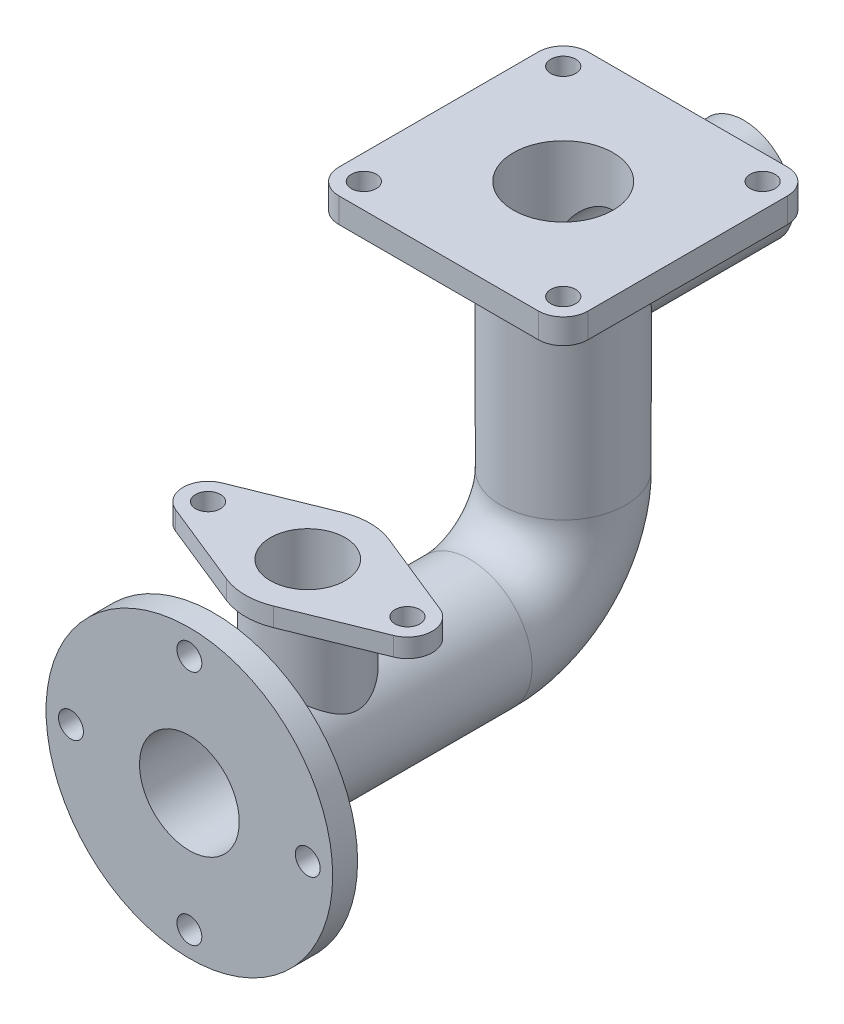
from build123d import *

# Parameters (mm, degrees)
SKETCH2_R                = 12.5
SKETCH2_R_2              = 10
BOSS_EXTRUDE1_START      = -5
SKETCH3_R                = 28.75
SKETCH3_R_2              = 10
BOSS_EXTRUDE1_DEPTH      = 5
HOLE1_D                  = 5
HOLE1_DEPTH              = 5
CIRPATTERN1_COUNT        = 4
SKETCH6_W                = 50
SKETCH6_H                = 50
SKETCH6_R                = 10
BOSS_EXTRUDE2_DEPTH      = 5
FILLET1_R                = 5
HOLE2_D                  = 5
BOSS_EXTRUDE3_REACH      = 120.882
BOSS_EXTRUDE3_END_RADIUS = 12.5
SKETCH9_R                = 10
HOLE3_REACH              = 120.882
HOLE3_BORE_R             = 7.5
SKETCH13_R               = 7.5
SKETCH13_R_2             = 2.5
BOSS_EXTRUDE4_DEPTH      = 3.75
BOSS_EXTRUDE5_REACH      = 135.902
BOSS_EXTRUDE5_END_RADIUS = 12.5
SKETCH14_R               = 10
HOLE4_REACH              = 135.902
HOLE4_BORE_R             = 7.5


with BuildPart() as part:
    # Sweep1: sweep along a path in Sketch1
    with BuildLine(Plane(origin=(0, 0, 0), x_dir=(0, 0, -1), z_dir=(1, 0, 0))) as sweep1_path:
        Line((0, 0), (56.25, 0))
        ThreePointArc((56.25, 0), (69.508252147, 5.491747853), (75, 18.75))
        Line((75, 18.75), (75, 68.75))
    # Sketch2 → Sweep1 (sweep)
    with BuildSketch(Plane.XY):
        Circle(SKETCH2_R)
        Circle(SKETCH2_R_2, mode=Mode.SUBTRACT)
    sweep(path=sweep1_path.line)

    # Sketch3 → Boss-Extrude1 (add)
    with BuildSketch(Plane.XY.offset(BOSS_EXTRUDE1_START)):
        Circle(SKETCH3_R)
        with Locations(Location((0, 0, 0), (0, 0, 270))):
            Circle(SKETCH3_R_2, mode=Mode.SUBTRACT)
    extrude(amount=BOSS_EXTRUDE1_DEPTH)

    # Hole1
    with Locations(Plane.XY):
        with Locations((23.75, 0)):
            hole1 = Hole(HOLE1_D / 2, depth=HOLE1_DEPTH)

    # CirPattern1: Hole1 ×4 about axis
    cirpattern1_axis = Axis((0, 0, 0), (0, 0, 1))
    for i in range(1, CIRPATTERN1_COUNT):
        add(hole1.rotate(cirpattern1_axis, i * 360 / CIRPATTERN1_COUNT), mode=Mode.SUBTRACT)

    # Sketch6 → Boss-Extrude2 (add)
    with BuildSketch(Plane(origin=(0, 68.75, 0), x_dir=(1, 0, 0), z_dir=(0, 1, 0))):
        with Locations((0, 75)):
            Rectangle(SKETCH6_W, SKETCH6_H)
        with Locations((0, 75)):
            Circle(SKETCH6_R, mode=Mode.SUBTRACT)
    extrude(amount=-BOSS_EXTRUDE2_DEPTH)

    # Fillet1
    fillet1_edges = [part.edges().sort_by_distance(p)[0] for p in [
        (25, 66.25, -100),
        (25, 66.25, -50),
        (-25, 66.25, -50),
        (-25, 66.25, -100),
    ]]
    fillet(fillet1_edges, radius=FILLET1_R)

    # Hole2 (through all)
    with Locations(Plane(origin=(0, 68.75, 0), x_dir=(1, 0, 0), z_dir=(0, 1, 0))):
        with Locations((-20, 55), (20, 55), (20, 95), (-20, 95)):
            Hole(HOLE2_D / 2)

    # Boss-Extrude3: up to this cylinder (the profile starts outside it)
    boss_extrude3_end = Plane(origin=(0, 0, -23.75), z_dir=(0, 0, -1)) * Cylinder(BOSS_EXTRUDE3_END_RADIUS, 267.764, mode=Mode.PRIVATE)
    # Sketch9 → Boss-Extrude3 (add, up to the surface)
    with BuildSketch(Plane(origin=(0, 28.75, 0), x_dir=(1, 0, 0), z_dir=(0, 1, 0)), mode=Mode.PRIVATE) as boss_extrude3_sk1:
        with Locations(Location((0, 23.75, 0), (0, 0, 270))):
            Circle(SKETCH9_R)
    boss_extrude3_tool1 = extrude(boss_extrude3_sk1.sketch, amount=-BOSS_EXTRUDE3_REACH, mode=Mode.PRIVATE) - boss_extrude3_end
    add(boss_extrude3_tool1.solids().sort_by_distance((0, 28.75, -23.75))[0])

    # Hole3 bore → Hole3 (cut, up to next)
    with BuildSketch(Plane(origin=(0, 28.75, 0), x_dir=(1, 0, 0), z_dir=(0, 1, 0)), mode=Mode.PRIVATE) as hole3_sk1:
        with Locations((0, 23.75)):
            Circle(HOLE3_BORE_R)
    hole3_tool1 = extrude(hole3_sk1.sketch, amount=-HOLE3_REACH, mode=Mode.PRIVATE) & part.part
    add(hole3_tool1.solids().sort_by_distance((0, 28.75, -23.75))[0], mode=Mode.SUBTRACT)

    # Sketch13 → Boss-Extrude4 (add)
    with BuildSketch(Plane(origin=(0, 28.75, 0), x_dir=(1, 0, 0), z_dir=(0, 1, 0))):
        with BuildLine():
            Line((-21.875, 28.385124054), (-4.6875, 35.337810136))
            ThreePointArc((-4.6875, 35.337810136), (0, 36.25), (4.6875, 35.337810136))
            Line((4.6875, 35.337810136), (21.875, 28.385124054))
            ThreePointArc((21.875, 28.385124054), (25, 23.75), (21.875, 19.114875946))
            Line((21.875, 19.114875946), (4.6875, 12.162189864))
            ThreePointArc((4.6875, 12.162189864), (0, 11.25), (-4.6875, 12.162189864))
            Line((-4.6875, 12.162189864), (-21.875, 19.114875946))
            ThreePointArc((-21.875, 19.114875946), (-25, 23.75), (-21.875, 28.385124054))
        make_face()
        with Locations(Location((0, 23.75, 0), (0, 0, 270))):
            Circle(SKETCH13_R, mode=Mode.SUBTRACT)
        with Locations(Location((-20, 23.75, 0), (0, 0, 270))):
            Circle(SKETCH13_R_2, mode=Mode.SUBTRACT)
        with Locations(Location((20, 23.75, 0), (0, 0, 270))):
            Circle(SKETCH13_R_2, mode=Mode.SUBTRACT)
    extrude(amount=-BOSS_EXTRUDE4_DEPTH)

    # Boss-Extrude5: up to this cylinder (the profile starts outside it)
    boss_extrude5_end = Plane(origin=(0, 51.25, -75), z_dir=(0, 1, 0)) * Cylinder(BOSS_EXTRUDE5_END_RADIUS, 297.804, mode=Mode.PRIVATE)
    # Sketch14 → Boss-Extrude5 (add, up to the surface)
    with BuildSketch(Plane.XY.offset(-111.25), mode=Mode.PRIVATE) as boss_extrude5_sk1:
        with Locations(Location((0, 51.25, 0), (0, 0, 180))):
            Circle(SKETCH14_R)
    boss_extrude5_tool1 = extrude(boss_extrude5_sk1.sketch, amount=BOSS_EXTRUDE5_REACH, mode=Mode.PRIVATE) - boss_extrude5_end
    add(boss_extrude5_tool1.solids().sort_by_distance((0, 51.25, -111.25))[0])

    # Hole4 bore → Hole4 (cut, up to next)
    with BuildSketch(Plane(origin=(0, 0, -111.25), x_dir=(-1, 0, 0), z_dir=(0, 0, -1)), mode=Mode.PRIVATE) as hole4_sk1:
        with Locations((0, 51.25)):
            Circle(HOLE4_BORE_R)
    hole4_tool1 = extrude(hole4_sk1.sketch, amount=-HOLE4_REACH, mode=Mode.PRIVATE) & part.part
    add(hole4_tool1.solids().sort_by_distance((0, 51.25, -111.25))[0], mode=Mode.SUBTRACT)


solid = part.part
